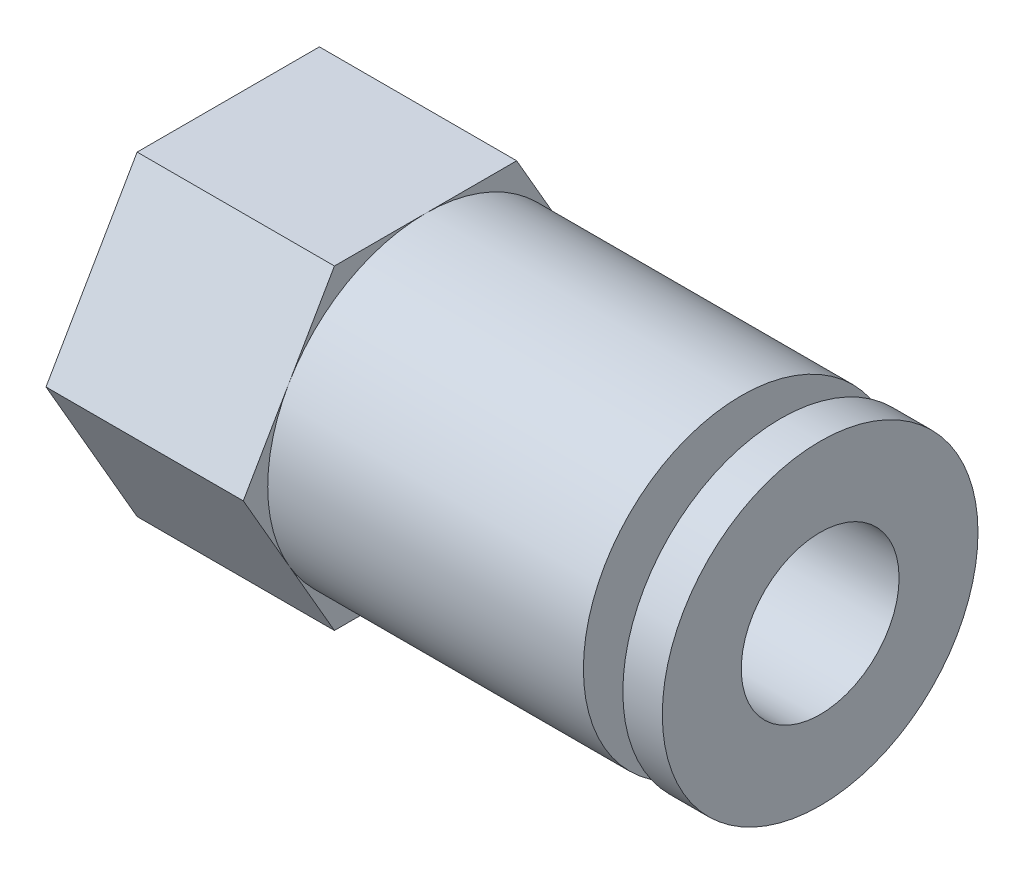
from build123d import *

# Parameters (mm, degrees)
EXTRUDE_1_DEPTH     = 5
SKETCH_2_R          = 4
EXTRUDE_2_DEPTH     = 8
SKETCH_3_R          = 2.5
EXTRUDE_3_DEPTH     = 1
SKETCH_4_R          = 4
EXTRUDE_4_DEPTH     = 1
SKETCH_5_R          = 2
CUT_EXTRUDE_1_DEPTH = 17.196707484


with BuildPart() as part:
    # 草图1 → 凸台-拉伸1 (new body)
    with BuildSketch(Plane(origin=(0, 0, 0), x_dir=(0, 0, -1), z_dir=(1, 0, 0))):
        Polygon((-2.309401077, 4), (-4.618802154, 0), (-2.309401077, -4), (2.309401077, -4), (4.618802154, 0), (2.309401077, 4), align=None)
    extrude(amount=EXTRUDE_1_DEPTH)

    # 草图2 → 凸台-拉伸2 (add)
    with BuildSketch(Plane(origin=(5, 0, 0), x_dir=(0, 0, -1), z_dir=(1, 0, 0))):
        with Locations(Location((0, 0, 0), (0, 0, 150))):
            Circle(SKETCH_2_R)
    extrude(amount=EXTRUDE_2_DEPTH)

    # 草图3 → 凸台-拉伸3 (add)
    with BuildSketch(Plane(origin=(13, 0, 0), x_dir=(0, 0, -1), z_dir=(1, 0, 0))):
        Circle(SKETCH_3_R)
    extrude(amount=EXTRUDE_3_DEPTH)

    # 草图4 → 凸台-拉伸4 (add)
    with BuildSketch(Plane(origin=(14, 0, 0), x_dir=(0, 0, -1), z_dir=(1, 0, 0))):
        with Locations(Location((0, 0, 0), (0, 0, 150))):
            Circle(SKETCH_4_R)
    extrude(amount=EXTRUDE_4_DEPTH)

    # 草图5 → 切除-拉伸1 (cut, through all)
    with BuildSketch(Plane(origin=(15, 0, 0), x_dir=(0, 0, -1), z_dir=(1, 0, 0))):
        Circle(SKETCH_5_R)
    extrude(amount=-CUT_EXTRUDE_1_DEPTH, mode=Mode.SUBTRACT)


solid = part.part
